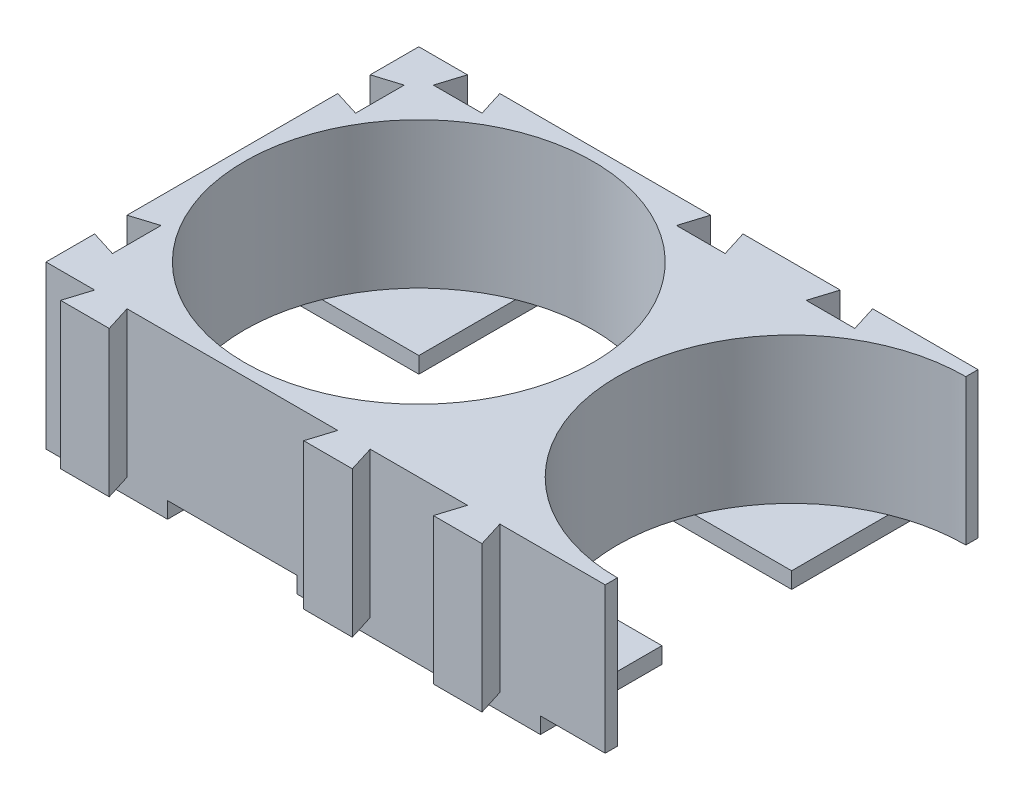
from build123d import *

# Parameters (mm, degrees)
SKETCH1_W           = 47.6
SKETCH1_H           = 24.6
BOSS_EXTRUDE1_DEPTH = 10
SKETCH2_R           = 10.75
CUT_EXTRUDE1_DEPTH  = 9
CUT_EXTRUDE2_DEPTH  = 9
SKETCH5_W           = 1.6
SKETCH5_H           = 24.6
CUT_EXTRUDE3_DEPTH  = 10
SKETCH6_W           = 46
SKETCH6_H           = 1.6
CUT_EXTRUDE4_DEPTH  = 10
BOSS_EXTRUDE2_DEPTH = 9
SKETCH10_W          = 46
SKETCH10_H          = 8.003908937
CUT_EXTRUDE5_DEPTH  = 1
SKETCH11_W          = 8
SKETCH11_H          = 23
CUT_EXTRUDE6_DEPTH  = 1
SKETCH12_W          = 13.355704333
SKETCH12_H          = 24.6
CUT_EXTRUDE8_DEPTH  = 10


with BuildPart() as part:
    # Sketch1 → Boss-Extrude1 (new body)
    with BuildSketch(Plane(origin=(0, 0, 0), x_dir=(1, 0, 0), z_dir=(0, 1, 0))):
        with Locations((23.8, 12.3)):
            Rectangle(SKETCH1_W, SKETCH1_H)
    extrude(amount=BOSS_EXTRUDE1_DEPTH)

    # Sketch2 → Cut-Extrude1 (cut)
    with BuildSketch(Plane(origin=(0, 10, 0), x_dir=(1, 0, 0), z_dir=(0, 1, 0))):
        with Locations(Location((11.5, 13.1, 0), (0, 0, 270))):
            Circle(SKETCH2_R)
        with Locations(Location((34.5, 13.1, 0), (0, 0, 270))):
            Circle(SKETCH2_R)
    extrude(amount=-CUT_EXTRUDE1_DEPTH, mode=Mode.SUBTRACT)

    # Sketch3 → Cut-Extrude2 (cut)
    with BuildSketch(Plane(origin=(0, 10, 0), x_dir=(1, 0, 0), z_dir=(0, 1, 0))):
        Polygon((3, 24.6), (2.5, 23), (5.5, 23), (5, 24.6), align=None)
        Polygon((18, 24.6), (17.5, 23), (20.5, 23), (20, 24.6), align=None)
        Polygon((26, 24.6), (25.5, 23), (28.5, 23), (28, 24.6), align=None)
        Polygon((41, 24.6), (40.5, 23), (43.5, 23), (43, 24.6), align=None)
        Polygon((0, 21.6), (1.6, 22.1), (1.6, 19.1), (0, 19.6), align=None)
        Polygon((0, 6.6), (1.6, 7.1), (1.6, 4.1), (0, 4.6), align=None)
    extrude(amount=-CUT_EXTRUDE2_DEPTH, mode=Mode.SUBTRACT)

    # Sketch5 → Cut-Extrude3 (cut)
    with BuildSketch(Plane(origin=(0, 10, 0), x_dir=(1, 0, 0), z_dir=(0, 1, 0))):
        with Locations((46.8, 12.3)):
            Rectangle(SKETCH5_W, SKETCH5_H)
    extrude(amount=-CUT_EXTRUDE3_DEPTH, mode=Mode.SUBTRACT)

    # Sketch6 → Cut-Extrude4 (cut)
    with BuildSketch(Plane(origin=(0, 10, 0), x_dir=(1, 0, 0), z_dir=(0, 1, 0))):
        with Locations((23, 0.8)):
            Rectangle(SKETCH6_W, SKETCH6_H)
    extrude(amount=-CUT_EXTRUDE4_DEPTH, mode=Mode.SUBTRACT)

    # Sketch7 → Boss-Extrude2 (add)
    with BuildSketch(Plane(origin=(0, 10, 0), x_dir=(1, 0, 0), z_dir=(0, 1, 0))):
        Polygon((46, 21.6), (47.6, 22.1), (47.6, 19.1), (46, 19.6), align=None)
        Polygon((46, 6.6), (47.6, 7.1), (47.6, 4.1), (46, 4.6), align=None)
        Polygon((3, 1.6), (2.5, 0), (5.5, 0), (5, 1.6), align=None)
        Polygon((18, 1.6), (17.5, 0), (20.5, 0), (20, 1.6), align=None)
        Polygon((26, 1.6), (25.5, 0), (28.5, 0), (28, 1.6), align=None)
        Polygon((41, 1.6), (40.5, 0), (43.5, 0), (43, 1.6), align=None)
    extrude(amount=-BOSS_EXTRUDE2_DEPTH)

    # Sketch10 → Cut-Extrude5 (cut)
    with BuildSketch(Plane.XZ):
        with Locations((23, -13.101954469)):
            Rectangle(SKETCH10_W, SKETCH10_H)
    extrude(amount=-CUT_EXTRUDE5_DEPTH, mode=Mode.SUBTRACT)

    # Sketch11 → Cut-Extrude6 (cut)
    with BuildSketch(Plane.XZ):
        with Locations((11.5, -13.1)):
            Rectangle(SKETCH11_W, SKETCH11_H)
        with Locations((34.5, -13.1)):
            Rectangle(SKETCH11_W, SKETCH11_H)
    extrude(amount=-CUT_EXTRUDE6_DEPTH, mode=Mode.SUBTRACT)

    # Sketch12 → Cut-Extrude8 (cut)
    with BuildSketch(Plane(origin=(0, 10, 0), x_dir=(1, 0, 0), z_dir=(0, 1, 0))):
        with Locations((41.177852167, 12.3)):
            Rectangle(SKETCH12_W, SKETCH12_H)
    extrude(amount=-CUT_EXTRUDE8_DEPTH, mode=Mode.SUBTRACT)


solid = part.part
